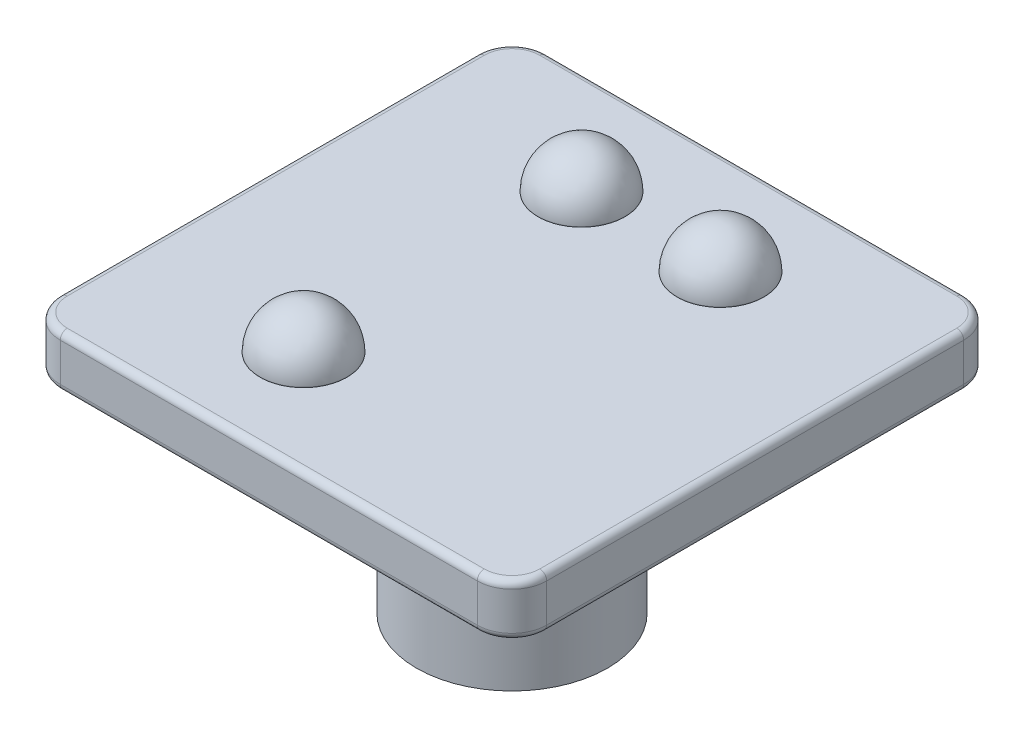
from build123d import *

# Parameters (mm, degrees)
BOSS_EXTRUDE1_DEPTH = 1.5
SKETCH2_R           = 2.75
BOSS_EXTRUDE2_DEPTH = 6
SKETCH3_W           = 1.1
SKETCH3_H           = 1.45
SKETCH3_W_2         = 1.45
SKETCH3_H_2         = 1.1
CUT_EXTRUDE1_DEPTH  = 6
CHAMFER1_SIZE       = 0.3
FILLET1_R           = 1
SKETCH4_R           = 1.25
BOSS_EXTRUDE3_DEPTH = 0.01
DOME1_FACE_RADIUS   = 1.25
DOME1_HEIGHT        = 1.25
DOME2_FACE_RADIUS   = 1.25
DOME2_HEIGHT        = 1.25
DOME5_FACE_RADIUS   = 1.25
DOME5_HEIGHT        = 1.25
FILLET3_R           = 0.2


with BuildPart() as part:
    # Sketch1 → Boss-Extrude1 (new body)
    with BuildSketch(Plane(origin=(0, 0, 0), x_dir=(1, 0, 0), z_dir=(0, 1, 0))):
        with BuildLine():
            Line((-7.324675649, 4.396717546), (4.675324351, 4.396717546))
            ThreePointArc((4.675324351, 4.396717546), (5.382431132, 4.103824327), (5.675324351, 3.396717546))
            Line((5.675324351, 3.396717546), (5.675324351, -8.603282454))
            ThreePointArc((5.675324351, -8.603282454), (5.382431132, -9.310389235), (4.675324351, -9.603282454))
            Line((4.675324351, -9.603282454), (-7.324675649, -9.603282454))
            ThreePointArc((-7.324675649, -9.603282454), (-8.03178243, -9.310389235), (-8.324675649, -8.603282454))
            Line((-8.324675649, -8.603282454), (-8.324675649, 3.396717546))
            ThreePointArc((-8.324675649, 3.396717546), (-8.03178243, 4.103824327), (-7.324675649, 4.396717546))
        make_face()
    extrude(amount=BOSS_EXTRUDE1_DEPTH)

    # Sketch2 → Boss-Extrude2 (add)
    with BuildSketch(Plane.XZ):
        with Locations(Location((-1.324675649, 2.603282454, 0), (0, 0, 270))):
            Circle(SKETCH2_R)
    extrude(amount=BOSS_EXTRUDE2_DEPTH)

    # Sketch3 → Cut-Extrude1 (cut)
    with BuildSketch(Plane.XZ.offset(6)):
        with Locations((-1.324675649, 3.878282454)):
            Rectangle(SKETCH3_W, SKETCH3_H)
        with Locations((-0.049675649, 2.603282454)):
            Rectangle(SKETCH3_W_2, SKETCH3_H_2)
        with Locations((-1.324675649, 2.603282454)):
            Rectangle(SKETCH3_W, SKETCH3_H_2)
        with Locations((-2.599675649, 2.603282454)):
            Rectangle(SKETCH3_W_2, SKETCH3_H_2)
        with Locations((-1.324675649, 1.328282454)):
            Rectangle(SKETCH3_W, SKETCH3_H)
    extrude(amount=-CUT_EXTRUDE1_DEPTH, mode=Mode.SUBTRACT)

    # Chamfer1
    chamfer1_edges = [part.edges().sort_by_distance(p)[0] for p in [
        (-0.774675649, -6, 3.878282454),
        (-0.049675649, -6, 3.153282454),
        (0.675324351, -6, 2.603282454),
        (-0.774675649, -6, 1.328282454),
        (-2.599675649, -6, 3.153282454),
        (-1.324675649, -6, 4.603282454),
        (-1.874675649, -6, 3.878282454),
        (-3.324675649, -6, 2.603282454),
        (-2.599675649, -6, 2.053282454),
        (-1.874675649, -6, 1.328282454),
        (-1.324675649, -6, 0.603282454),
        (-0.049675649, -6, 2.053282454),
    ]]
    chamfer(chamfer1_edges, length=CHAMFER1_SIZE)

    # Fillet1
    fillet1_edges = [part.edges().sort_by_distance(p)[0] for p in [
        (-1.324675649, 0, 5.353282454),
    ]]
    fillet(fillet1_edges, radius=FILLET1_R)

    # Sketch4 → Boss-Extrude3 (add)
    with BuildSketch(Plane(origin=(0, 1.5, 0), x_dir=(1, 0, 0), z_dir=(0, 1, 0))):
        with Locations(Location((-3.324675649, 1.396717546, 0), (0, 0, 90))):
            Circle(SKETCH4_R)
        with Locations(Location((-3.324675649, -6.603282454, 0), (0, 0, 90))):
            Circle(SKETCH4_R)
        with Locations(Location((0.675324351, 1.396717546, 0), (0, 0, 90))):
            Circle(SKETCH4_R)
    extrude(amount=BOSS_EXTRUDE3_DEPTH)

    # Dome1: a dome of height H over a round flat face of radius A is a cap of a sphere of radius (A * A + H * H) / (2 * H)
    dome1_r = (DOME1_FACE_RADIUS * DOME1_FACE_RADIUS + DOME1_HEIGHT * DOME1_HEIGHT) / (2 * DOME1_HEIGHT)
    dome1_base = Plane((-3.324675649, 1.51, -1.396717546), z_dir=(0, 1, 0))
    with Locations(dome1_base.offset(DOME1_HEIGHT - dome1_r)):
        dome1_ball = Sphere(dome1_r, mode=Mode.PRIVATE)
    add(split(dome1_ball, bisect_by=dome1_base, keep=Keep.TOP, mode=Mode.PRIVATE))

    # Dome2: a dome of height H over a round flat face of radius A is a cap of a sphere of radius (A * A + H * H) / (2 * H)
    dome2_r = (DOME2_FACE_RADIUS * DOME2_FACE_RADIUS + DOME2_HEIGHT * DOME2_HEIGHT) / (2 * DOME2_HEIGHT)
    dome2_base = Plane((0.675324351, 1.51, -1.396717546), z_dir=(0, 1, 0))
    with Locations(dome2_base.offset(DOME2_HEIGHT - dome2_r)):
        dome2_ball = Sphere(dome2_r, mode=Mode.PRIVATE)
    add(split(dome2_ball, bisect_by=dome2_base, keep=Keep.TOP, mode=Mode.PRIVATE))

    # Dome5: a dome of height H over a round flat face of radius A is a cap of a sphere of radius (A * A + H * H) / (2 * H)
    dome5_r = (DOME5_FACE_RADIUS * DOME5_FACE_RADIUS + DOME5_HEIGHT * DOME5_HEIGHT) / (2 * DOME5_HEIGHT)
    dome5_base = Plane((-3.324675649, 1.51, 6.603282454), z_dir=(0, 1, 0))
    with Locations(dome5_base.offset(DOME5_HEIGHT - dome5_r)):
        dome5_ball = Sphere(dome5_r, mode=Mode.PRIVATE)
    add(split(dome5_ball, bisect_by=dome5_base, keep=Keep.TOP, mode=Mode.PRIVATE))

    # Fillet3
    fillet3_edges = [part.edges().sort_by_distance(p)[0] for p in [
        (5.382431132, 1.5, 9.310389235),
        (-1.324675649, 0, 9.603282454),
        (-8.03178243, 0, 9.310389235),
        (5.675324351, 1.5, 2.603282454),
        (5.382431132, 1.5, -4.103824327),
        (-1.324675649, 1.5, -4.396717546),
        (-8.03178243, 1.5, -4.103824327),
        (-8.324675649, 1.5, 2.603282454),
        (-8.03178243, 1.5, 9.310389235),
        (-1.324675649, 1.5, 9.603282454),
        (-8.324675649, 0, 2.603282454),
        (-8.03178243, 0, -4.103824327),
        (-1.324675649, 0, -4.396717546),
        (5.382431132, 0, -4.103824327),
        (5.675324351, 0, 2.603282454),
        (5.382431132, 0, 9.310389235),
    ]]
    fillet(fillet3_edges, radius=FILLET3_R)


solid = part.part
